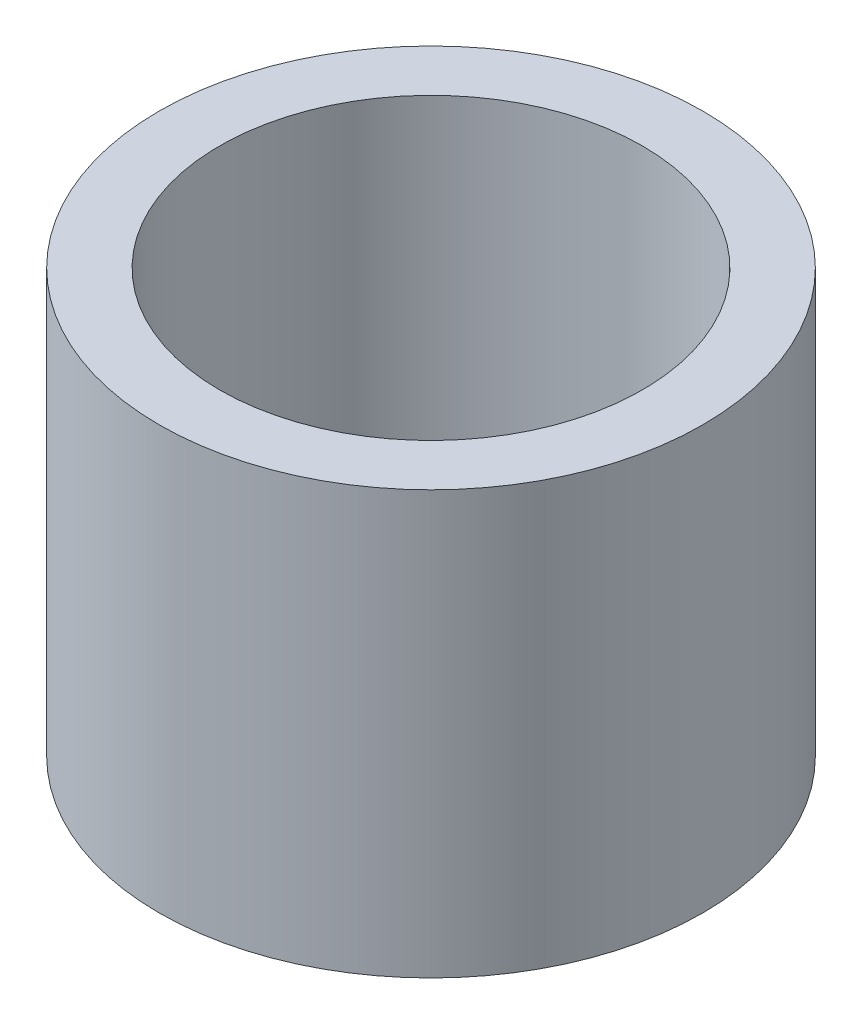
from build123d import *

# Parameters (mm, degrees)
SKETCH2_R           = 2.25
SKETCH2_R_2         = 1.75
BOSS_EXTRUDE1_DEPTH = 3.5


with BuildPart() as part:
    # Sketch2 → Boss-Extrude1 (new body)
    with BuildSketch(Plane(origin=(0, 0, 0), x_dir=(1, 0, 0), z_dir=(0, 1, 0))):
        with Locations(Location((0, 0, 0), (0, 0, 270))):
            Circle(SKETCH2_R)
        with Locations(Location((0, 0, 0), (0, 0, 270))):
            Circle(SKETCH2_R_2, mode=Mode.SUBTRACT)
    extrude(amount=BOSS_EXTRUDE1_DEPTH)


solid = part.part
